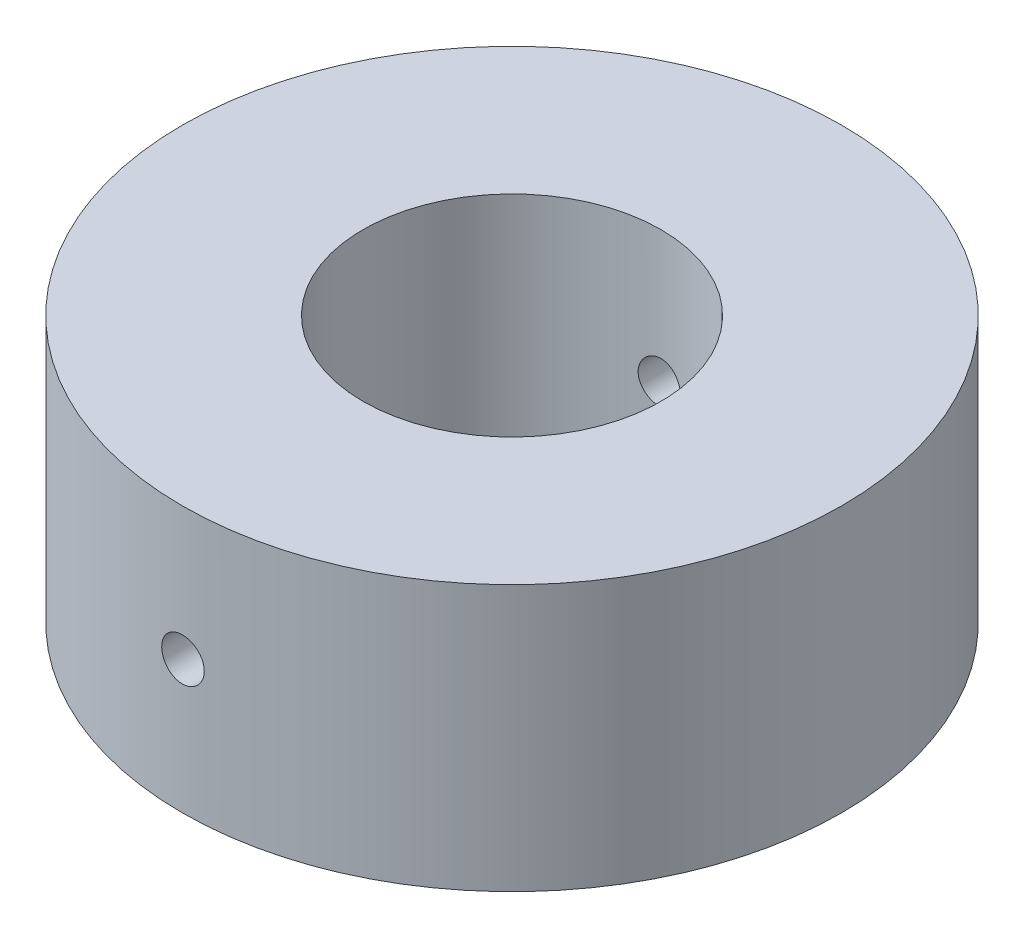
from build123d import *

# Parameters (mm, degrees)
SKETCH1_R                        = 31
BOSS_EXTRUDE1_DEPTH              = 12.5
CUT_EXTRUDE1_DEPTH               = 46.587827323
CUT_EXTRUDE1_DEPTH_BACK          = 46.587827323
SKETCH2_R                        = 2
M30X2_0_TAPPED_HOLE1_D           = 28
M30X2_0_TAPPED_HOLE1_DEPTH       = 25
M30X2_0_TAPPED_HOLE1_CSINK_D     = 30.05
M30X2_0_TAPPED_HOLE1_CSINK_ANGLE = 90
M30X2_0_TAPPED_HOLE1_TIP         = 8.412048666


with BuildPart() as part:
    # Sketch1 → Boss-Extrude1 (new, symmetric)
    with BuildSketch(Plane(origin=(0, 0, 0), x_dir=(1, 0, 0), z_dir=(0, 1, 0))):
        with Locations(Location((0, 0, 0), (0, 0, 270))):
            Circle(SKETCH1_R)
    extrude(amount=BOSS_EXTRUDE1_DEPTH, both=True)

    # Sketch2 → Cut-Extrude1 (cut, two sides: drawn at the far end of the back side and taken through both)
    with BuildSketch(Plane.XY.offset(-CUT_EXTRUDE1_DEPTH_BACK)):
        Circle(SKETCH2_R)
    extrude(amount=CUT_EXTRUDE1_DEPTH + CUT_EXTRUDE1_DEPTH_BACK, mode=Mode.SUBTRACT)

    # M30x2.0 Tapped Hole1
    with Locations(Plane(origin=(0, -12.5, 0), x_dir=(-1, 0, 0), z_dir=(0, -1, 0))):
        with Locations((0, 0)):
            CounterSinkHole(M30X2_0_TAPPED_HOLE1_D / 2, M30X2_0_TAPPED_HOLE1_CSINK_D / 2, depth=M30X2_0_TAPPED_HOLE1_DEPTH, counter_sink_angle=M30X2_0_TAPPED_HOLE1_CSINK_ANGLE)
            with Locations((0, 0, -(M30X2_0_TAPPED_HOLE1_DEPTH + M30X2_0_TAPPED_HOLE1_TIP / 2))):  # 118° drill point
                Cone(0, M30X2_0_TAPPED_HOLE1_D / 2, M30X2_0_TAPPED_HOLE1_TIP, mode=Mode.SUBTRACT)


solid = part.part
